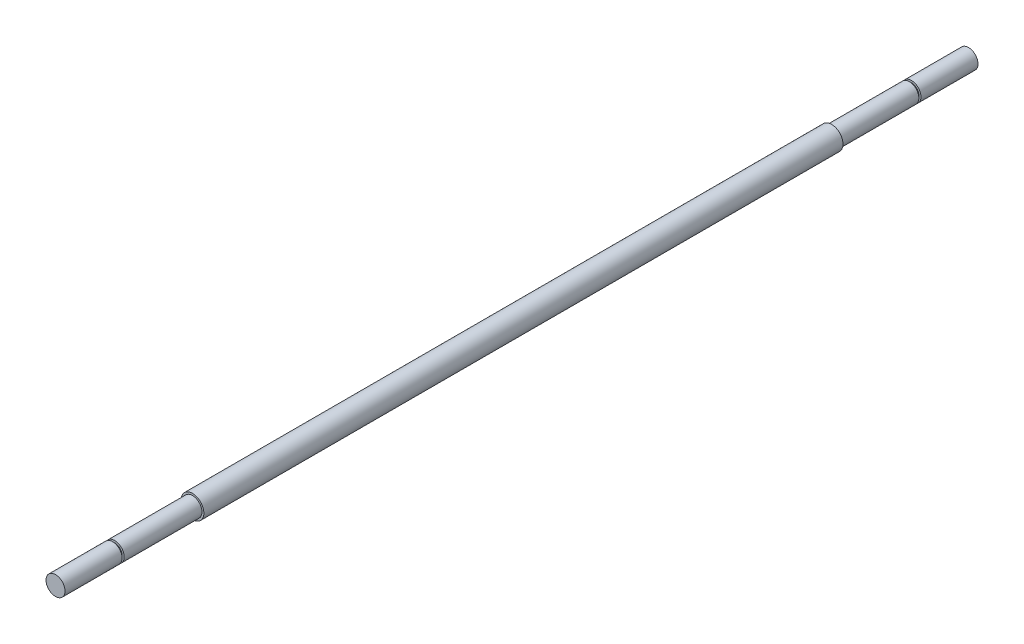
from build123d import *

# Parameters (mm, degrees)
SKETCH1_R           = 7.62
BOSS_EXTRUDE1_DEPTH = 609.6
FILLET1_R           = 0.25
SKETCH2_W           = 1.27
SKETCH2_H           = 91.44
SKETCH4_W           = 2.6416
SKETCH4_H           = 1.397


with BuildPart() as part:
    # Sketch1 → Boss-Extrude1 (new body)
    with BuildSketch(Plane.XY):
        with Locations(Location((0, 0, 0), (0, 0, 180))):
            Circle(SKETCH1_R)
    extrude(amount=BOSS_EXTRUDE1_DEPTH)

    # Fillet1
    fillet1_edges = [part.edges().sort_by_distance(p)[0] for p in [
        (7.62, 0, 0),
        (7.62, 0, 609.6),
    ]]
    fillet(fillet1_edges, radius=FILLET1_R)

    # Sketch2 → Cut-Revolve2 (revolve, cut)
    with BuildSketch(Plane(origin=(0, 0, 0), x_dir=(1, 0, 0), z_dir=(0, 1, 0)), mode=Mode.PRIVATE) as cut_revolve2_sk:
        with Locations((6.985, -45.72)):
            Rectangle(SKETCH2_W, SKETCH2_H)
    cut_revolve2 = revolve(cut_revolve2_sk.sketch.rotate(Axis((0, 0, 0.780201326), (0, 0, 1)), 180), axis=Axis((0, 0, 0.780201326), (0, 0, 1)), mode=Mode.SUBTRACT)

    # Sketch4 → Cut-Revolve3 (revolve, cut)
    with BuildSketch(Plane(origin=(0, 0, 0), x_dir=(1, 0, 0), z_dir=(0, 1, 0)), mode=Mode.PRIVATE) as cut_revolve3_sk:
        with Locations((6.35, -38.7985)):
            Rectangle(SKETCH4_W, SKETCH4_H)
    cut_revolve3 = revolve(cut_revolve3_sk.sketch.rotate(Axis((0, 0, 0), (0, 0, 1)), 180), axis=Axis((0, 0, 0), (0, 0, 1)), mode=Mode.SUBTRACT)

    # Mirror1: Cut-Revolve2, Cut-Revolve3 across plane
    add(cut_revolve2.mirror(Plane.XY.offset(304.8)), mode=Mode.SUBTRACT)
    add(cut_revolve3.mirror(Plane.XY.offset(304.8)), mode=Mode.SUBTRACT)


solid = part.part
